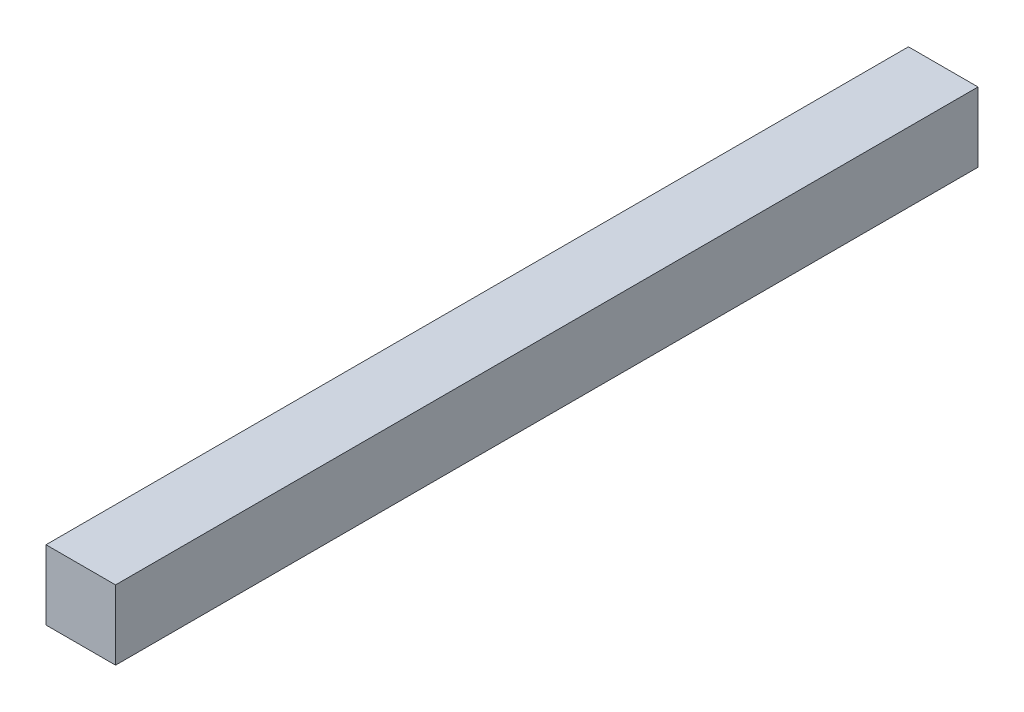
from build123d import *

# Parameters (mm, degrees)
SZKIC1_W                    = 5
SZKIC1_H                    = 5
DODANIE_WYCI_GNI_CIE1_DEPTH = 62


with BuildPart() as part:
    # Szkic1 → Dodanie-wyciągnięcie1 (new body)
    with BuildSketch(Plane.XY):
        with Locations((-8.988755852, 1.78960396)):
            Rectangle(SZKIC1_W, SZKIC1_H)
    extrude(amount=DODANIE_WYCI_GNI_CIE1_DEPTH)


solid = part.part
